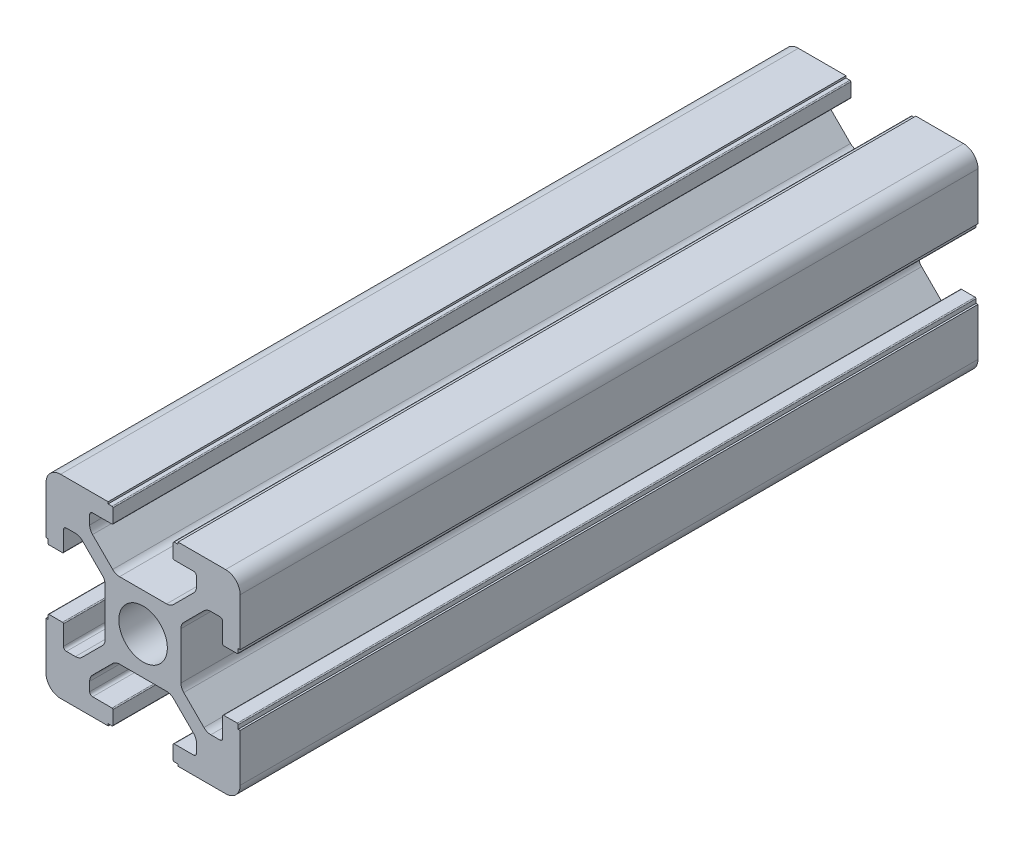
from build123d import *

# Parameters (mm, degrees)
SKETCH_1_R      = 2.5
EXTRUDE_1_DEPTH = 76
FILLET_1_R      = 1.5


with BuildPart() as part:
    # 草图1 → 凸台-拉伸1 (new body)
    with BuildSketch(Plane.XY):
        with BuildLine():
            Line((20, 13.6), (20, 20))
            Line((20, 20), (13.6, 20))
            Line((13.6, 20), (13.6, 19.8))
            Line((13.6, 19.8), (13.2, 19.8))
            ThreePointArc((13.2, 19.8), (13.129289322, 19.770710678), (13.1, 19.7))
            Line((13.1, 19.7), (13.1, 18.3))
            ThreePointArc((13.1, 18.3), (13.129289322, 18.229289322), (13.2, 18.2))
            Line((13.2, 18.2), (15.2, 18.2))
            ThreePointArc((15.2, 18.2), (15.412132034, 18.112132034), (15.5, 17.9))
            Line((15.5, 17.9), (15.5, 16.974873734))
            ThreePointArc((15.5, 16.974873734), (15.423879533, 16.592190302), (15.207106781, 16.267766953))
            Line((15.207106781, 16.267766953), (13.132233047, 14.192893219))
            ThreePointArc((13.132233047, 14.192893219), (12.807809698, 13.976120467), (12.425126266, 13.9))
            Line((12.425126266, 13.9), (7.574873734, 13.9))
            ThreePointArc((7.574873734, 13.9), (7.192190302, 13.976120467), (6.867766953, 14.192893219))
            Line((6.867766953, 14.192893219), (4.792893219, 16.267766953))
            ThreePointArc((4.792893219, 16.267766953), (4.576120467, 16.592190302), (4.5, 16.974873734))
            Line((4.5, 16.974873734), (4.5, 17.9))
            ThreePointArc((4.5, 17.9), (4.587867966, 18.112132034), (4.8, 18.2))
            Line((4.8, 18.2), (6.8, 18.2))
            ThreePointArc((6.8, 18.2), (6.870710678, 18.229289322), (6.9, 18.3))
            Line((6.9, 18.3), (6.9, 19.7))
            ThreePointArc((6.9, 19.7), (6.870710678, 19.770710678), (6.8, 19.8))
            Line((6.8, 19.8), (6.4, 19.8))
            Line((6.4, 19.8), (6.4, 20))
            Line((6.4, 20), (0, 20))
            Line((0, 20), (0, 13.6))
            Line((0, 13.6), (0.2, 13.6))
            Line((0.2, 13.6), (0.2, 13.2))
            ThreePointArc((0.2, 13.2), (0.229289322, 13.129289322), (0.3, 13.1))
            Line((0.3, 13.1), (1.7, 13.1))
            ThreePointArc((1.7, 13.1), (1.770710678, 13.129289322), (1.8, 13.2))
            Line((1.8, 13.2), (1.8, 15.2))
            ThreePointArc((1.8, 15.2), (1.887867966, 15.412132034), (2.1, 15.5))
            Line((2.1, 15.5), (3.025126266, 15.5))
            ThreePointArc((3.025126266, 15.5), (3.407809698, 15.423879533), (3.732233047, 15.207106781))
            Line((3.732233047, 15.207106781), (5.807106781, 13.132233047))
            ThreePointArc((5.807106781, 13.132233047), (6.023879533, 12.807809698), (6.1, 12.425126266))
            Line((6.1, 12.425126266), (6.1, 7.574873734))
            ThreePointArc((6.1, 7.574873734), (6.023879533, 7.192190302), (5.807106781, 6.867766953))
            Line((5.807106781, 6.867766953), (3.732233047, 4.792893219))
            ThreePointArc((3.732233047, 4.792893219), (3.407809698, 4.576120467), (3.025126266, 4.5))
            Line((3.025126266, 4.5), (2.1, 4.5))
            ThreePointArc((2.1, 4.5), (1.887867966, 4.587867966), (1.8, 4.8))
            Line((1.8, 4.8), (1.8, 6.8))
            ThreePointArc((1.8, 6.8), (1.770710678, 6.870710678), (1.7, 6.9))
            Line((1.7, 6.9), (0.3, 6.9))
            ThreePointArc((0.3, 6.9), (0.229289322, 6.870710678), (0.2, 6.8))
            Line((0.2, 6.8), (0.2, 6.4))
            Line((0.2, 6.4), (0, 6.4))
            Line((0, 6.4), (0, 0))
            Line((0, 0), (6.4, 0))
            Line((6.4, 0), (6.4, 0.2))
            Line((6.4, 0.2), (6.8, 0.2))
            ThreePointArc((6.8, 0.2), (6.870710678, 0.229289322), (6.9, 0.3))
            Line((6.9, 0.3), (6.9, 1.7))
            ThreePointArc((6.9, 1.7), (6.870710678, 1.770710678), (6.8, 1.8))
            Line((6.8, 1.8), (4.8, 1.8))
            ThreePointArc((4.8, 1.8), (4.587867966, 1.887867966), (4.5, 2.1))
            Line((4.5, 2.1), (4.5, 3.025126266))
            ThreePointArc((4.5, 3.025126266), (4.576120467, 3.407809698), (4.792893219, 3.732233047))
            Line((4.792893219, 3.732233047), (6.867766953, 5.807106781))
            ThreePointArc((6.867766953, 5.807106781), (7.192190302, 6.023879533), (7.574873734, 6.1))
            Line((7.574873734, 6.1), (12.425126266, 6.1))
            ThreePointArc((12.425126266, 6.1), (12.807809698, 6.023879533), (13.132233047, 5.807106781))
            Line((13.132233047, 5.807106781), (15.207106781, 3.732233047))
            ThreePointArc((15.207106781, 3.732233047), (15.423879533, 3.407809698), (15.5, 3.025126266))
            Line((15.5, 3.025126266), (15.5, 2.1))
            ThreePointArc((15.5, 2.1), (15.412132034, 1.887867966), (15.2, 1.8))
            Line((15.2, 1.8), (13.2, 1.8))
            ThreePointArc((13.2, 1.8), (13.129289322, 1.770710678), (13.1, 1.7))
            Line((13.1, 1.7), (13.1, 0.3))
            ThreePointArc((13.1, 0.3), (13.129289322, 0.229289322), (13.2, 0.2))
            Line((13.2, 0.2), (13.6, 0.2))
            Line((13.6, 0.2), (13.6, 0))
            Line((13.6, 0), (20, 0))
            Line((20, 0), (20, 6.4))
            Line((20, 6.4), (19.8, 6.4))
            Line((19.8, 6.4), (19.8, 6.8))
            ThreePointArc((19.8, 6.8), (19.770710678, 6.870710678), (19.7, 6.9))
            Line((19.7, 6.9), (18.3, 6.9))
            ThreePointArc((18.3, 6.9), (18.229289322, 6.870710678), (18.2, 6.8))
            Line((18.2, 6.8), (18.2, 4.8))
            ThreePointArc((18.2, 4.8), (18.112132034, 4.587867966), (17.9, 4.5))
            Line((17.9, 4.5), (16.974873734, 4.5))
            ThreePointArc((16.974873734, 4.5), (16.592190302, 4.576120467), (16.267766953, 4.792893219))
            Line((16.267766953, 4.792893219), (14.192893219, 6.867766953))
            ThreePointArc((14.192893219, 6.867766953), (13.976120467, 7.192190302), (13.9, 7.574873734))
            Line((13.9, 7.574873734), (13.9, 12.425126266))
            ThreePointArc((13.9, 12.425126266), (13.976120467, 12.807809698), (14.192893219, 13.132233047))
            Line((14.192893219, 13.132233047), (16.267766953, 15.207106781))
            ThreePointArc((16.267766953, 15.207106781), (16.592190302, 15.423879533), (16.974873734, 15.5))
            Line((16.974873734, 15.5), (17.9, 15.5))
            ThreePointArc((17.9, 15.5), (18.112132034, 15.412132034), (18.2, 15.2))
            Line((18.2, 15.2), (18.2, 13.2))
            ThreePointArc((18.2, 13.2), (18.229289322, 13.129289322), (18.3, 13.1))
            Line((18.3, 13.1), (19.7, 13.1))
            ThreePointArc((19.7, 13.1), (19.770710678, 13.129289322), (19.8, 13.2))
            Line((19.8, 13.2), (19.8, 13.6))
            Line((19.8, 13.6), (20, 13.6))
        make_face()
        with Locations((10, 10)):
            Circle(SKETCH_1_R, mode=Mode.SUBTRACT)
    extrude(amount=EXTRUDE_1_DEPTH)

    # 圆角1
    fillet_1_edges = [part.edges().sort_by_distance(p)[0] for p in [
        (0, 0, 38),
        (0, 20, 38),
        (20, 20, 38),
        (20, 0, 38),
    ]]
    fillet(fillet_1_edges, radius=FILLET_1_R)


solid = part.part
